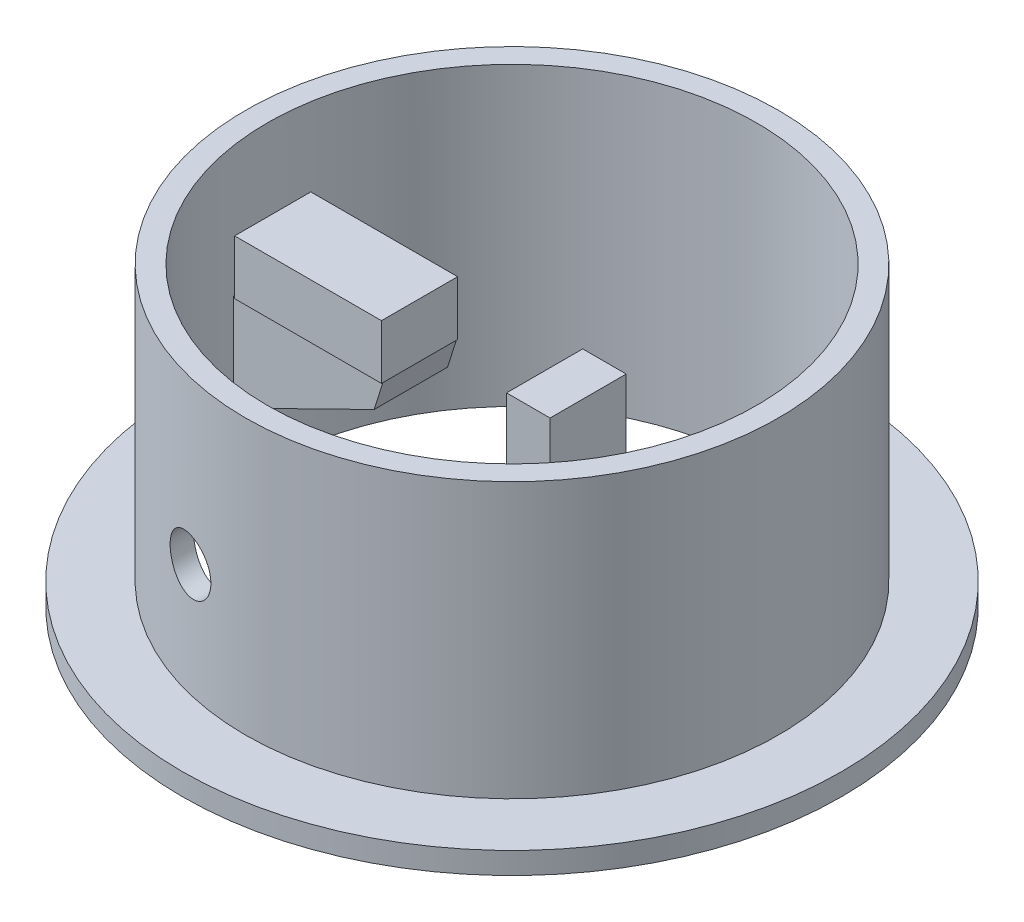
from build123d import *

# Parameters (mm, degrees)
SKETCH1_R             = 60.625
SKETCH1_R_2           = 45
BOSS_EXTRUDE1_DEPTH   = 4
SKETCH2_R             = 49
SKETCH2_R_2           = 45
BOSS_EXTRUDE2_DEPTH   = 50.5
SKETCH4_W             = 8
SKETCH4_H             = 40.5
BOSS_EXTRUDE4_DEPTH   = 7
SKETCH4_W_2           = 27
SKETCH4_H_2           = 10
BOSS_EXTRUDE4_2_DEPTH = 7
BOSS_EXTRUDE5_DEPTH   = 4
SKETCH6_R             = 5
CUT_EXTRUDE2_DEPTH    = 52
CUT_EXTRUDE6_DEPTH    = 100.503925853
BOSS_EXTRUDE6_DEPTH   = 6.75


with BuildPart() as part:
    # Sketch1 → Boss-Extrude1 (new body)
    with BuildSketch(Plane(origin=(0, 0, 0), x_dir=(1, 0, 0), z_dir=(0, 1, 0))):
        with Locations(Location((0, 0, 0), (0, 0, 270))):
            Circle(SKETCH1_R)
        with Locations(Location((0, 0, 0), (0, 0, 270))):
            Circle(SKETCH1_R_2, mode=Mode.SUBTRACT)
    extrude(amount=BOSS_EXTRUDE1_DEPTH)

    # Sketch2 → Boss-Extrude2 (add)
    with BuildSketch(Plane(origin=(0, 4, 0), x_dir=(1, 0, 0), z_dir=(0, 1, 0))):
        with Locations(Location((0, 0, 0), (0, 0, 270))):
            Circle(SKETCH2_R)
        with Locations(Location((0, 0, 0), (0, 0, 270))):
            Circle(SKETCH2_R_2, mode=Mode.SUBTRACT)
    extrude(amount=BOSS_EXTRUDE2_DEPTH)



with BuildPart() as body_2:
    # Sketch4 → Boss-Extrude4 (new, symmetric)
    with BuildSketch(Plane.XY):
        with Locations((10, 20.25)):
            Rectangle(SKETCH4_W, SKETCH4_H)
    extrude(amount=BOSS_EXTRUDE4_DEPTH, both=True)


with BuildPart() as body_3:
    # Sketch4 → Boss-Extrude4 2 (new, symmetric)
    with BuildSketch(Plane.XY):
        with Locations((-30.5, 35.5)):
            Rectangle(SKETCH4_W_2, SKETCH4_H_2)
    extrude(amount=BOSS_EXTRUDE4_2_DEPTH, both=True)


with BuildPart() as part_1:
    add(part.part)

    add(body_2.part)  # Boss-Extrude5 merges body 2
    # Sketch5 → Boss-Extrude5 (add)
    with BuildSketch(Plane(origin=(0, 0, 0.832419338), x_dir=(1, 0, 0), z_dir=(0, -1, 0))):
        with BuildLine():
            Line((0.92268666, 14.579552818), (36.10584122, 30.137929754))
            ThreePointArc((36.10584122, 30.137929754), (47.46850162, -1.287411864), (36.651216878, -32.904630242))
            Line((36.651216878, -32.904630242), (0.92268666, -16.029114558))
            Line((0.92268666, -16.029114558), (0.92268666, 14.579552818))
        make_face()
    extrude(amount=-BOSS_EXTRUDE5_DEPTH)

    # Sketch6 → Cut-Extrude2 (cut)
    with BuildSketch(Plane.XY):
        with Locations(Location((-11.847358964, 24.485616242, 0), (0, 0, 180))):
            Circle(SKETCH6_R)
    extrude(amount=CUT_EXTRUDE2_DEPTH, mode=Mode.SUBTRACT)

    # Sketch11 → Cut-Extrude6 (cut, through all)
    with BuildSketch(Plane(origin=(0, 4, 0), x_dir=(1, 0, 0), z_dir=(0, 1, 0))):
        with BuildLine():
            Line((16.265526008, 12.732401326), (16.265526008, -6.549664017))
            Line((16.265526008, -6.549664017), (5.714961953, -6.549664017))
            Line((5.714961953, -6.549664017), (5.714961953, -11.643039768))
            Line((5.714961953, -11.643039768), (30.818028154, -22.557416377))
            ThreePointArc((30.818028154, -22.557416377), (39.374347706, -1.214976289), (32.152007517, 20.615006655))
            Line((32.152007517, 20.615006655), (16.265526008, 12.732401326))
        make_face()
    extrude(amount=-CUT_EXTRUDE6_DEPTH, mode=Mode.SUBTRACT)


    add(body_3.part)  # Boss-Extrude6 merges body 3
    # Sketch17 → Boss-Extrude6 (add, symmetric)
    with BuildSketch(Plane.XY):
        Polygon((-17, 30.5), (-45, 30.5), (-45, 12.445827276), (-18.590132897, 25.433454532), align=None)
    extrude(amount=BOSS_EXTRUDE6_DEPTH, both=True)


solid = part_1.part
